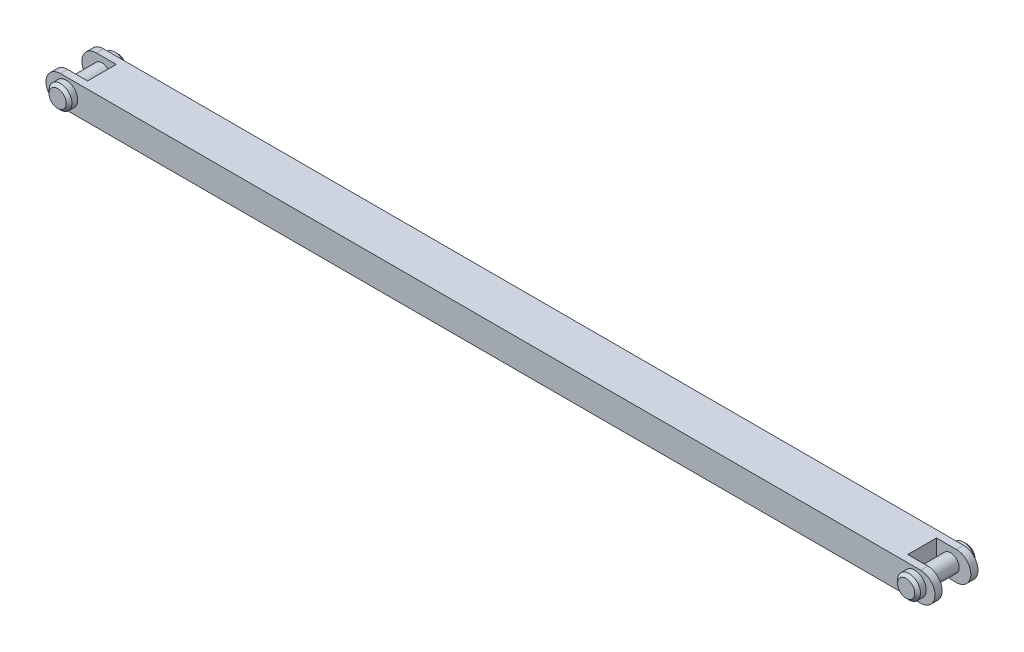
from build123d import *

# Parameters (mm, degrees)
BOSS_EXTRU_1_DEPTH           = 15
ENL_V_MAT_EXTRU_1_REACH      = 312.524
ESQUISSE2_W                  = 12
ESQUISSE2_H                  = 10
BOSS_EXTRU_2_REACH           = 312.413
ESQUISSE3_R                  = 3
ESQUISSE4_R                  = 4
BOSS_EXTRU_3_DEPTH           = 3
CHANFREIN1_SIZE              = 1
CHANFREIN1_OF_SYM_TRIE1_SIZE = 1


with BuildPart() as part:
    # Esquisse1 → Boss.-Extru.1 (new body)
    with BuildSketch(Plane.XY):
        with BuildLine():
            Line((5, 0), (305, 0))
            ThreePointArc((305, 0), (310, 5), (305, 10))
            Line((305, 10), (5, 10))
            ThreePointArc((5, 10), (0, 5), (5, 0))
        make_face()
    extrude(amount=BOSS_EXTRU_1_DEPTH)

    # Esquisse2 → Enlèv. mat.-Extru.1 (cut, up to next)
    with BuildSketch(Plane(origin=(0, 10, 0), x_dir=(1, 0, 0), z_dir=(0, 1, 0)), mode=Mode.PRIVATE) as enl_v_mat_extru_1_sk1:
        with Locations((6, -7.5)):
            Rectangle(ESQUISSE2_W, ESQUISSE2_H)
    enl_v_mat_extru_1_tool1 = extrude(enl_v_mat_extru_1_sk1.sketch, amount=-ENL_V_MAT_EXTRU_1_REACH, mode=Mode.PRIVATE) & part.part
    # Esquisse2 → Enlèv. mat.-Extru.1 (cut, up to next)
    with BuildSketch(Plane(origin=(0, 10, 0), x_dir=(1, 0, 0), z_dir=(0, 1, 0)), mode=Mode.PRIVATE) as enl_v_mat_extru_1_sk2:
        with Locations((304, -7.5)):
            Rectangle(ESQUISSE2_W, ESQUISSE2_H)
    enl_v_mat_extru_1_tool2 = extrude(enl_v_mat_extru_1_sk2.sketch, amount=-ENL_V_MAT_EXTRU_1_REACH, mode=Mode.PRIVATE) & part.part
    add(enl_v_mat_extru_1_tool1.solids().sort_by_distance((6, 10, 7.5))[0], mode=Mode.SUBTRACT)
    add(enl_v_mat_extru_1_tool2.solids().sort_by_distance((304, 10, 7.5))[0], mode=Mode.SUBTRACT)

    # Esquisse3 → Boss.-Extru.2 (add, up to next)
    with BuildSketch(Plane.XY.offset(2.5), mode=Mode.PRIVATE) as boss_extru_2_sk1:
        with Locations(Location((7.054871053, 5, 0), (0, 0, 180))):
            Circle(ESQUISSE3_R)
    boss_extru_2_tool1 = extrude(boss_extru_2_sk1.sketch, amount=BOSS_EXTRU_2_REACH, mode=Mode.PRIVATE) - part.part
    # Esquisse3 → Boss.-Extru.2 (add, up to next)
    with BuildSketch(Plane.XY.offset(2.5), mode=Mode.PRIVATE) as boss_extru_2_sk2:
        with Locations(Location((302.945128947, 5, 0), (0, 0, 180))):
            Circle(ESQUISSE3_R)
    boss_extru_2_tool2 = extrude(boss_extru_2_sk2.sketch, amount=BOSS_EXTRU_2_REACH, mode=Mode.PRIVATE) - part.part
    add(boss_extru_2_tool1.solids().sort_by_distance((7.054871, 5, 2.5))[0])
    add(boss_extru_2_tool2.solids().sort_by_distance((302.945129, 5, 2.5))[0])

    # Esquisse4 → Boss.-Extru.3 (add)
    with BuildSketch(Plane.XY.offset(15)):
        with Locations(Location((7.054871053, 5, 0), (0, 0, 180))):
            Circle(ESQUISSE4_R)
        with Locations(Location((302.945128947, 5, 0), (0, 0, 180))):
            Circle(ESQUISSE4_R)
    boss_extru_3 = extrude(amount=BOSS_EXTRU_3_DEPTH)

    # Chanfrein1
    chanfrein1_edges = [part.edges().sort_by_distance(p)[0] for p in [
        (11.054871053, 5, 18),
        (306.945128947, 5, 18),
    ]]
    chamfer(chanfrein1_edges, length=CHANFREIN1_SIZE)

    # Symétrie1: Boss.-Extru.3 across plane
    add(boss_extru_3.mirror(Plane.XY.offset(7.5)))

    # Chanfrein1 of Symétrie1
    chanfrein1_of_sym_trie1_edges = [part.edges().sort_by_distance(p)[0] for p in [
        (11.054871053, 5, -3),
        (306.945128947, 5, -3),
    ]]
    chamfer(chanfrein1_of_sym_trie1_edges, length=CHANFREIN1_OF_SYM_TRIE1_SIZE)


solid = part.part
